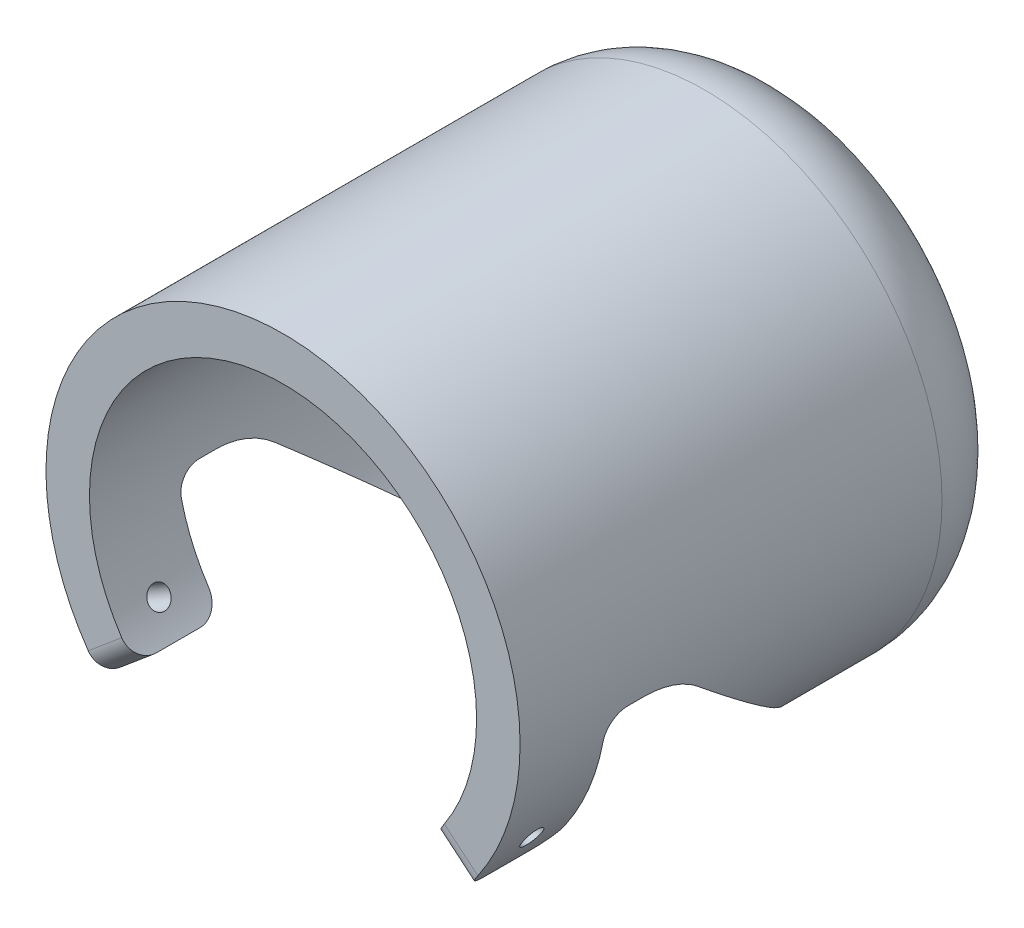
from build123d import *

# Parameters (mm, degrees)
SKETCH_1_R               = 54.5
EXTRUDE_1_DEPTH          = 58.5
FILLET_1_R               = 20
SHELL_1_T                = -10
CUT_EXTRUDE_1_DEPTH      = 97.761304305
CUT_EXTRUDE_1_DEPTH_BACK = 97.761304305
CUT_EXTRUDE_2_REACH      = 142.105
SKETCH_4_R               = 30
CUT_EXTRUDE_3_DEPTH      = 141.105317607
FILLET_2_R               = 5


with BuildPart() as part:
    # 草图1 → 凸台-拉伸1 (new, symmetric)
    with BuildSketch(Plane.XY):
        Circle(SKETCH_1_R)
    extrude(amount=EXTRUDE_1_DEPTH, both=True)

    # 圆角1
    fillet_1_edges = [part.edges().sort_by_distance(p)[0] for p in [
        (-54.5, 0, -58.5),
    ]]
    fillet(fillet_1_edges, radius=FILLET_1_R)

    # 抽壳1
    shell_1_openings = [part.faces().sort_by_distance(p)[0] for p in [
        (0, 0, 58.5),
    ]]
    offset(amount=SHELL_1_T, openings=shell_1_openings, kind=Kind.INTERSECTION)

    # 草图2 → 切除-拉伸1 (cut, two sides: drawn at the far end of the back side and taken through both)
    with BuildSketch(Plane(origin=(0, 0, 0), x_dir=(0, 0, -1), z_dir=(1, 0, 0)).offset(-CUT_EXTRUDE_1_DEPTH_BACK)):
        with BuildLine():
            Line((-38.5, -54.5), (-38.5, -10))
            ThreePointArc((-38.5, -10), (-37.035533906, -6.464466094), (-33.5, -5))
            Line((-33.5, -5), (-29.771207519, -5))
            ThreePointArc((-29.771207519, -5), (-22.930804652, -6.206147584), (-16.915455325, -9.679111138))
            Line((-16.915455325, -9.679111138), (36.5, -54.5))
            Line((36.5, -54.5), (-38.5, -54.5))
        make_face()
    extrude(amount=CUT_EXTRUDE_1_DEPTH + CUT_EXTRUDE_1_DEPTH_BACK, mode=Mode.SUBTRACT)

    # 草图3 → 切除-拉伸2 (cut, up to next)
    with BuildSketch(Plane.XY.offset(58.5), mode=Mode.PRIVATE) as cut_extrude_2_sk1:
        with BuildLine():
            Line((34.088977719, -28.604048631), (41.74942215, -35.031924728))
            ThreePointArc((41.74942215, -35.031924728), (0, -54.5), (-41.74942215, -35.031924728))
            Line((-41.74942215, -35.031924728), (-34.088977719, -28.604048631))
            ThreePointArc((-34.088977719, -28.604048631), (0, -44.5), (34.088977719, -28.604048631))
        make_face()
    cut_extrude_2_tool1 = extrude(cut_extrude_2_sk1.sketch, amount=-CUT_EXTRUDE_2_REACH, mode=Mode.PRIVATE) & part.part
    add(cut_extrude_2_tool1.solids().sort_by_distance((0, -53.625777, 58.5))[0], mode=Mode.SUBTRACT)

    # 草图4 → 切除-拉伸3 (cut, through all)
    with BuildSketch(Plane.XY.offset(58.5)):
        Circle(SKETCH_4_R)
    extrude(amount=-CUT_EXTRUDE_3_DEPTH, mode=Mode.SUBTRACT)

    # 圆角2
    fillet_2_edges = [part.edges().sort_by_distance(p)[0] for p in [
        (37.919199934, -31.817986679, 38.5),
        (-37.919199934, -31.817986679, 38.5),
        (-37.919199934, -31.817986679, 58.5),
        (37.919199934, -31.817986679, 58.5),
    ]]
    fillet(fillet_2_edges, radius=FILLET_2_R)

    # 草图6 → 切除-旋转1 (revolve, cut)
    with BuildSketch(Plane.XY.offset(48.5), mode=Mode.PRIVATE) as cut_revolve_1_sk:
        Polygon((0, 0), (1.25, 2.165063509), (68.054528667, -36.404549099), (66.804528667, -38.569612609), align=None)
    cut_revolve_1 = revolve(cut_revolve_1_sk.sketch.rotate(Axis((0, 0, 48.5), (0.8660254037844364, -0.500000000000004, 0)), 180), axis=Axis((0, 0, 48.5), (0.8660254037844364, -0.500000000000004, 0)), mode=Mode.SUBTRACT)

    # 镜向2: 切除-旋转1 across plane
    add(cut_revolve_1.mirror(Plane(origin=(0, 0, 0), x_dir=(0, 0, 1), z_dir=(1, 0, 0))), mode=Mode.SUBTRACT)


solid = part.part
